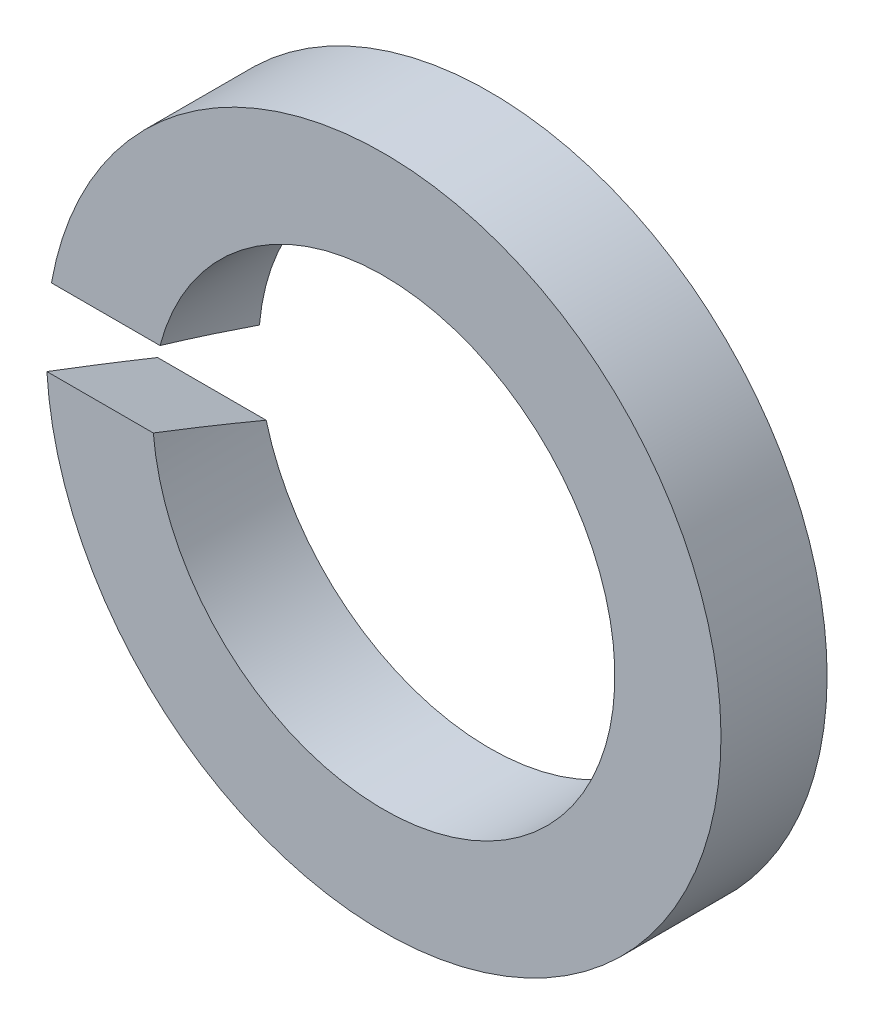
from build123d import *

# Parameters (mm, degrees)
SKETCH_1_R          = 4.45
SKETCH_1_R_2        = 3.05
EXTRUDE_1_DEPTH     = 1.4
CUT_EXTRUDE_1_DEPTH = 7.447092368


with BuildPart() as part:
    # Эскиз1 → Вытянуть1 (new body)
    with BuildSketch(Plane.XY):
        Circle(SKETCH_1_R)
        Circle(SKETCH_1_R_2, mode=Mode.SUBTRACT)
    extrude(amount=EXTRUDE_1_DEPTH)

    # Эскиз2 → Вырез-Вытянуть1 (cut, through all)
    with BuildSketch(Plane(origin=(0, 0, 0), x_dir=(0, 0, -1), z_dir=(1, 0, 0))):
        Polygon((0, 0.266667945), (-1.4, 0.776226272), (-1.4, 0), (-1.4, -0.266667945), (0, -0.776226272), (0, 0), align=None)
    extrude(amount=-CUT_EXTRUDE_1_DEPTH, mode=Mode.SUBTRACT)


solid = part.part
